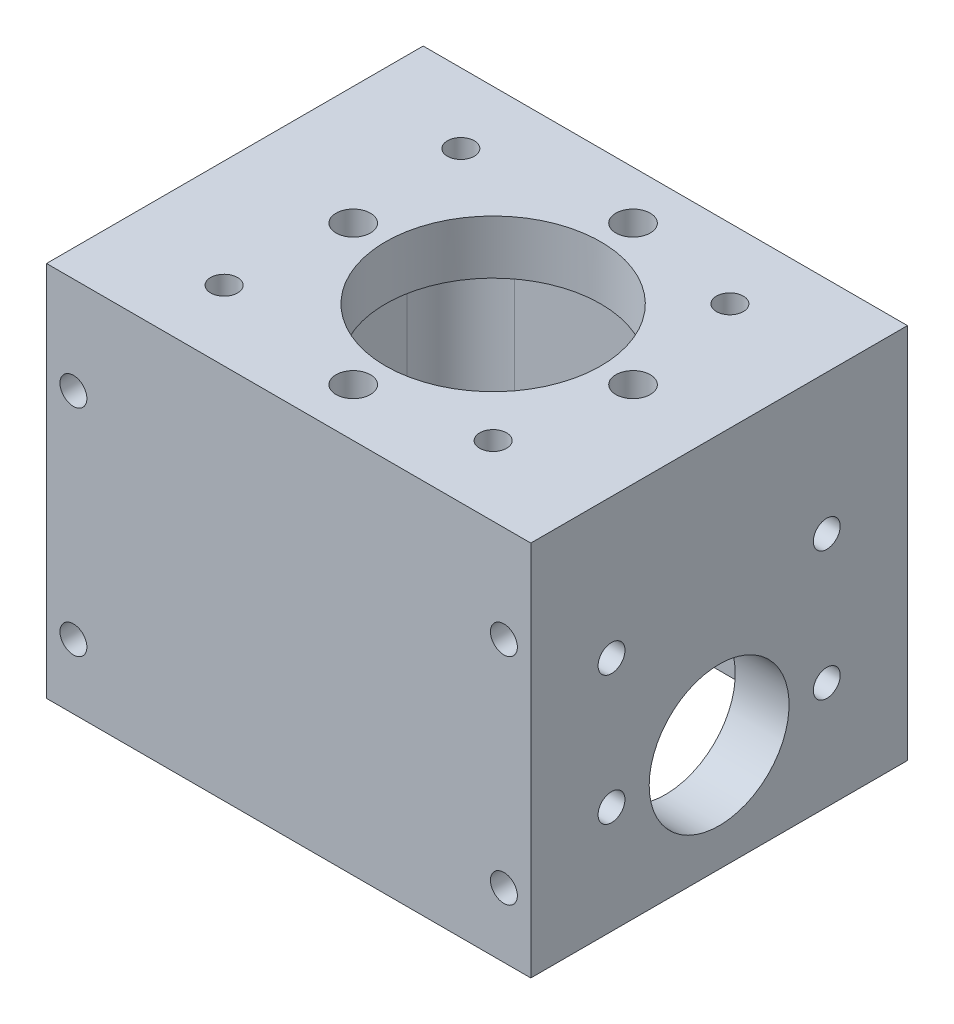
from build123d import *

# Parameters (mm, degrees)
ESQUISSE1_W                         = 45
ESQUISSE1_H                         = 35
BOSS_EXTRU_1_DEPTH                  = 35
ESQUISSE2_R                         = 10
ENL_V_MAT_EXTRU_1_DEPTH             = 10
ESQUISSE3_W                         = 35
ESQUISSE3_H                         = 35
ENL_V_MAT_EXTRU_2_DEPTH             = 30
ESQUISSE4_R                         = 6.5
ENL_V_MAT_EXTRU_3_DEPTH             = 60.634302209
ESQUISSE15_W                        = 35
ESQUISSE15_H                        = 1.5
BOSS_EXTRU_2_DEPTH                  = 30
CONG_1_R                            = 5
DIAM_TRE_DU_PER_AGE_3_2_3_2_1_D     = 3.2
DIAM_TRE_DU_PER_AGE_3_2_3_2_1_DEPTH = 7
TROU_TARAUD_M3X0_52_D               = 2.5
TROU_TARAUD_M3X0_52_DEPTH           = 6.5
TROU_TARAUD_M3X0_52_TIP             = 0.751075774
TROU_TARAUD_M3X0_53_D               = 2.5
TROU_TARAUD_M3X0_53_DEPTH           = 6.5
TROU_TARAUD_M3X0_53_TIP             = 0.751075774
TROU_TARAUD_M3X0_54_D               = 2.5
TROU_TARAUD_M3X0_54_DEPTH           = 6.5
TROU_TARAUD_M3X0_54_TIP             = 0.751075774
TROU_TARAUD_M3X0_56_D               = 2.5
TROU_TARAUD_M3X0_56_DEPTH           = 6.5
TROU_TARAUD_M3X0_56_TIP             = 0.751075774
TROU_TARAUD_M3X0_57_D               = 2.5


with BuildPart() as part:
    # Esquisse1 → Boss.-Extru.1 (new body)
    with BuildSketch(Plane.XY):
        Rectangle(ESQUISSE1_W, ESQUISSE1_H)
    extrude(amount=BOSS_EXTRU_1_DEPTH)

    # Esquisse2 → Enlèv. mat.-Extru.1 (cut)
    with BuildSketch(Plane(origin=(0, 17.5, 0), x_dir=(1, 0, 0), z_dir=(0, 1, 0))):
        with Locations(Location((1.5, -17.5, 0), (0, 0, 270))):
            Circle(ESQUISSE2_R)
    extrude(amount=-ENL_V_MAT_EXTRU_1_DEPTH, mode=Mode.SUBTRACT)

    # Esquisse3 → Enlèv. mat.-Extru.2 (cut)
    with BuildSketch(Plane.XZ.offset(17.5)):
        with Locations((0, 17.5)):
            Rectangle(ESQUISSE3_W, ESQUISSE3_H)
    extrude(amount=-ENL_V_MAT_EXTRU_2_DEPTH, mode=Mode.SUBTRACT)

    # Esquisse4 → Enlèv. mat.-Extru.3 (cut, through all)
    with BuildSketch(Plane.ZY.offset(22.5)):
        with Locations((17.5, -7.5)):
            Circle(ESQUISSE4_R)
    extrude(amount=-ENL_V_MAT_EXTRU_3_DEPTH, mode=Mode.SUBTRACT)

    # Esquisse15 → Boss.-Extru.2 (add)
    with BuildSketch(Plane.XZ.offset(-12.5)):
        with Locations((0, 34.25)):
            Rectangle(ESQUISSE15_W, ESQUISSE15_H)
        with Locations((0, 0.75)):
            Rectangle(ESQUISSE15_W, ESQUISSE15_H)
    extrude(amount=BOSS_EXTRU_2_DEPTH)

    # Congé1
    cong_1_edges = [part.edges().sort_by_distance(p)[0] for p in [
        (17.5, -2.5, 33.5),
        (-17.5, -2.5, 33.5),
        (17.5, -2.5, 1.5),
        (-17.5, -2.5, 1.5),
    ]]
    fillet(cong_1_edges, radius=CONG_1_R)

    # Diamètre du perçage Ø3.2 (3.2)1
    with Locations(Plane(origin=(0, 12.5, 0), x_dir=(-1, 0, 0), z_dir=(0, -1, 0))):
        with Locations((-14.5, -17.5), (-1.5, -4.5), (11.5, -17.5), (-1.5, -30.5)):
            Hole(DIAM_TRE_DU_PER_AGE_3_2_3_2_1_D / 2, depth=DIAM_TRE_DU_PER_AGE_3_2_3_2_1_DEPTH)

    # Trou taraudé M3x0.52
    with Locations(Plane(origin=(0, -17.5, 0), x_dir=(-1, 0, 0), z_dir=(0, -1, 0))):
        with Locations((-20, -7.5), (20, -27.5), (-20, -27.5), (20, -7.5)):
            Hole(TROU_TARAUD_M3X0_52_D / 2, depth=TROU_TARAUD_M3X0_52_DEPTH)
            with Locations((0, 0, -(TROU_TARAUD_M3X0_52_DEPTH + TROU_TARAUD_M3X0_52_TIP / 2))):  # 118° drill point
                Cone(0, TROU_TARAUD_M3X0_52_D / 2, TROU_TARAUD_M3X0_52_TIP, mode=Mode.SUBTRACT)

    # Trou taraudé M3x0.53
    with Locations(Plane(origin=(0, 0, 0), x_dir=(-1, 0, 0), z_dir=(0, 0, -1))):
        with Locations((-20, 8.5), (20, -11.5), (-20, -11.5), (20, 8.5)):
            Hole(TROU_TARAUD_M3X0_53_D / 2, depth=TROU_TARAUD_M3X0_53_DEPTH)
            with Locations((0, 0, -(TROU_TARAUD_M3X0_53_DEPTH + TROU_TARAUD_M3X0_53_TIP / 2))):  # 118° drill point
                Cone(0, TROU_TARAUD_M3X0_53_D / 2, TROU_TARAUD_M3X0_53_TIP, mode=Mode.SUBTRACT)

    # Trou taraudé M3x0.54
    with Locations(Plane.XY.offset(35)):
        with Locations((20, 8.5), (-20, 8.5), (20, -11.5), (-20, -11.5)):
            Hole(TROU_TARAUD_M3X0_54_D / 2, depth=TROU_TARAUD_M3X0_54_DEPTH)
            with Locations((0, 0, -(TROU_TARAUD_M3X0_54_DEPTH + TROU_TARAUD_M3X0_54_TIP / 2))):  # 118° drill point
                Cone(0, TROU_TARAUD_M3X0_54_D / 2, TROU_TARAUD_M3X0_54_TIP, mode=Mode.SUBTRACT)

    # Trou taraudé M3x0.56
    with Locations(Plane(origin=(22.5, 0, 0), x_dir=(0, 0, -1), z_dir=(1, 0, 0))):
        with Locations((-27.5, -7.5), (-7.5, 4.5), (-27.5, 4.5), (-7.5, -7.5)):
            Hole(TROU_TARAUD_M3X0_56_D / 2, depth=TROU_TARAUD_M3X0_56_DEPTH)
            with Locations((0, 0, -(TROU_TARAUD_M3X0_56_DEPTH + TROU_TARAUD_M3X0_56_TIP / 2))):  # 118° drill point
                Cone(0, TROU_TARAUD_M3X0_56_D / 2, TROU_TARAUD_M3X0_56_TIP, mode=Mode.SUBTRACT)

    # Trou taraudé M3x0.57 (through all)
    with Locations(Plane(origin=(0, 12.5, 0), x_dir=(-1, 0, 0), z_dir=(0, -1, 0))):
        with Locations((-12.5, -28.5), (12.5, -6.5), (-12.5, -6.5), (12.5, -28.5)):
            Hole(TROU_TARAUD_M3X0_57_D / 2)


solid = part.part
